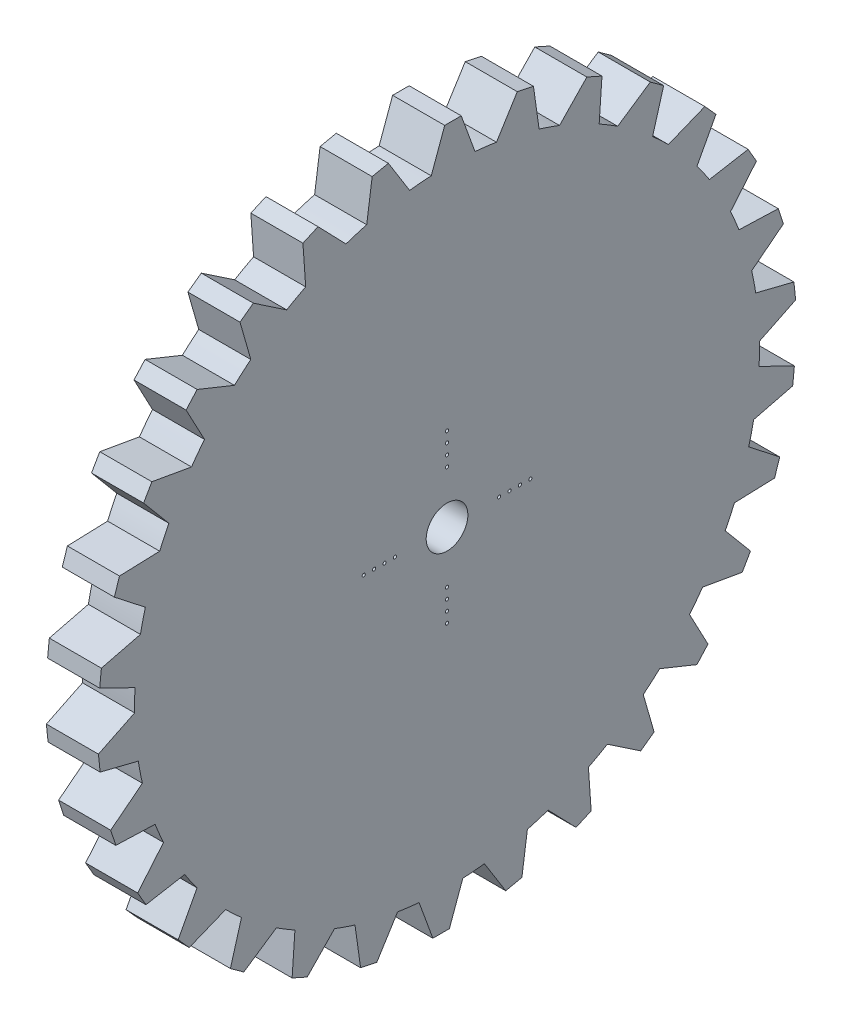
from build123d import *

# Parameters (mm, degrees)
SKETCH1_R                   = 30
SKETCH1_R_2                 = 2
BOSS_EXTRUDE2_DEPTH         = 5
SKETCH2_R                   = 0.15
CUT_EXTRUDE1_DEPTH          = 43.720018727
LPATTERN1_COUNT             = 4
LPATTERN1_PITCH             = 1
CIRPATTERN1_COUNT           = 4
CIRPATTERN1_COPY_1_SKETCH_R = 0.15
CIRPATTERN1_COPY_1_DEPTH    = 43.720018727
CIRPATTERN1_COPY_2_SKETCH_R = 0.15
CIRPATTERN1_COPY_2_DEPTH    = 43.720018727
CIRPATTERN1_COPY_3_SKETCH_R = 0.15
CIRPATTERN1_COPY_3_DEPTH    = 43.720018727
CIRPATTERN1_COPY_4_SKETCH_R = 0.15
CIRPATTERN1_COPY_4_DEPTH    = 43.720018727
CIRPATTERN1_COPY_5_SKETCH_R = 0.15
CIRPATTERN1_COPY_5_DEPTH    = 43.720018727
CIRPATTERN1_COPY_6_SKETCH_R = 0.15
CIRPATTERN1_COPY_6_DEPTH    = 43.720018727
CIRPATTERN1_COPY_7_SKETCH_R = 0.15
CIRPATTERN1_COPY_7_DEPTH    = 43.720018727
CIRPATTERN1_COPY_8_SKETCH_R = 0.15
CIRPATTERN1_COPY_8_DEPTH    = 43.720018727
CIRPATTERN1_COPY_9_SKETCH_R = 0.15
CIRPATTERN1_COPY_9_DEPTH    = 43.720018727
BOSS_EXTRUDE3_DEPTH         = 5
CIRPATTERN2_COUNT           = 30


with BuildPart() as part:
    # Sketch1 → Boss-Extrude2 (new body)
    with BuildSketch(Plane(origin=(0, 0, 0), x_dir=(0, 0, -1), z_dir=(1, 0, 0))):
        Circle(SKETCH1_R)
        Circle(SKETCH1_R_2, mode=Mode.SUBTRACT)
    extrude(amount=BOSS_EXTRUDE2_DEPTH)

    # Sketch2 → Cut-Extrude1 (cut, through all)
    with BuildSketch(Plane(origin=(5, 0, 0), x_dir=(0, 0, -1), z_dir=(1, 0, 0))):
        with Locations((0, 5)):
            Circle(SKETCH2_R)
    cut_extrude1 = extrude(amount=-CUT_EXTRUDE1_DEPTH, mode=Mode.SUBTRACT)

    # LPattern1: Cut-Extrude1 ×4
    with Locations(*[(0, i * LPATTERN1_PITCH, 0) for i in range(1, LPATTERN1_COUNT)]):
        add(cut_extrude1, mode=Mode.SUBTRACT)

    # CirPattern1: Cut-Extrude1 ×4 about axis
    cirpattern1_axis = Axis((0, 0, 0), (1, 0, 0))
    for i in range(1, CIRPATTERN1_COUNT):
        add(cut_extrude1.rotate(cirpattern1_axis, i * 360 / CIRPATTERN1_COUNT), mode=Mode.SUBTRACT)

    # CirPattern1 copy 1 sketch → CirPattern1 copy 1 (cut, through all)
    with BuildSketch(Plane(origin=(5, 0, 1), x_dir=(0, 1, 0), z_dir=(1, 0, 0))):
        with Locations((0, 5)):
            Circle(CIRPATTERN1_COPY_1_SKETCH_R)
    extrude(amount=-CIRPATTERN1_COPY_1_DEPTH, mode=Mode.SUBTRACT)

    # CirPattern1 copy 2 sketch → CirPattern1 copy 2 (cut, through all)
    with BuildSketch(Plane(origin=(5, -1, 0), x_dir=(0, 0, 1), z_dir=(1, 0, 0))):
        with Locations((0, 5)):
            Circle(CIRPATTERN1_COPY_2_SKETCH_R)
    extrude(amount=-CIRPATTERN1_COPY_2_DEPTH, mode=Mode.SUBTRACT)

    # CirPattern1 copy 3 sketch → CirPattern1 copy 3 (cut, through all)
    with BuildSketch(Plane(origin=(5, 0, -1), x_dir=(0, -1, 0), z_dir=(1, 0, 0))):
        with Locations((0, 5)):
            Circle(CIRPATTERN1_COPY_3_SKETCH_R)
    extrude(amount=-CIRPATTERN1_COPY_3_DEPTH, mode=Mode.SUBTRACT)

    # CirPattern1 copy 4 sketch → CirPattern1 copy 4 (cut, through all)
    with BuildSketch(Plane(origin=(5, 0, 2), x_dir=(0, 1, 0), z_dir=(1, 0, 0))):
        with Locations((0, 5)):
            Circle(CIRPATTERN1_COPY_4_SKETCH_R)
    extrude(amount=-CIRPATTERN1_COPY_4_DEPTH, mode=Mode.SUBTRACT)

    # CirPattern1 copy 5 sketch → CirPattern1 copy 5 (cut, through all)
    with BuildSketch(Plane(origin=(5, -2, 0), x_dir=(0, 0, 1), z_dir=(1, 0, 0))):
        with Locations((0, 5)):
            Circle(CIRPATTERN1_COPY_5_SKETCH_R)
    extrude(amount=-CIRPATTERN1_COPY_5_DEPTH, mode=Mode.SUBTRACT)

    # CirPattern1 copy 6 sketch → CirPattern1 copy 6 (cut, through all)
    with BuildSketch(Plane(origin=(5, 0, -2), x_dir=(0, -1, 0), z_dir=(1, 0, 0))):
        with Locations((0, 5)):
            Circle(CIRPATTERN1_COPY_6_SKETCH_R)
    extrude(amount=-CIRPATTERN1_COPY_6_DEPTH, mode=Mode.SUBTRACT)

    # CirPattern1 copy 7 sketch → CirPattern1 copy 7 (cut, through all)
    with BuildSketch(Plane(origin=(5, 0, 3), x_dir=(0, 1, 0), z_dir=(1, 0, 0))):
        with Locations((0, 5)):
            Circle(CIRPATTERN1_COPY_7_SKETCH_R)
    extrude(amount=-CIRPATTERN1_COPY_7_DEPTH, mode=Mode.SUBTRACT)

    # CirPattern1 copy 8 sketch → CirPattern1 copy 8 (cut, through all)
    with BuildSketch(Plane(origin=(5, -3, 0), x_dir=(0, 0, 1), z_dir=(1, 0, 0))):
        with Locations((0, 5)):
            Circle(CIRPATTERN1_COPY_8_SKETCH_R)
    extrude(amount=-CIRPATTERN1_COPY_8_DEPTH, mode=Mode.SUBTRACT)

    # CirPattern1 copy 9 sketch → CirPattern1 copy 9 (cut, through all)
    with BuildSketch(Plane(origin=(5, 0, -3), x_dir=(0, -1, 0), z_dir=(1, 0, 0))):
        with Locations((0, 5)):
            Circle(CIRPATTERN1_COPY_9_SKETCH_R)
    extrude(amount=-CIRPATTERN1_COPY_9_DEPTH, mode=Mode.SUBTRACT)

    # Sketch7 → Boss-Extrude3 (add)
    with BuildSketch(Plane(origin=(5, 0, 0), x_dir=(0, 0, -1), z_dir=(1, 0, 0))):
        Polygon((-1.681504774, 29.509212722), (2.818495226, 29.509212722), (1.362614288, 33.509212722), (-0.225623837, 33.509212722), align=None)
    boss_extrude3 = extrude(amount=-BOSS_EXTRUDE3_DEPTH)

    # CirPattern2: Boss-Extrude3 ×30 about axis
    cirpattern2_axis = Axis((0, 0, 0), (1, 0, 0))
    for i in range(1, CIRPATTERN2_COUNT):
        add(boss_extrude3.rotate(cirpattern2_axis, i * 360 / CIRPATTERN2_COUNT))


solid = part.part
